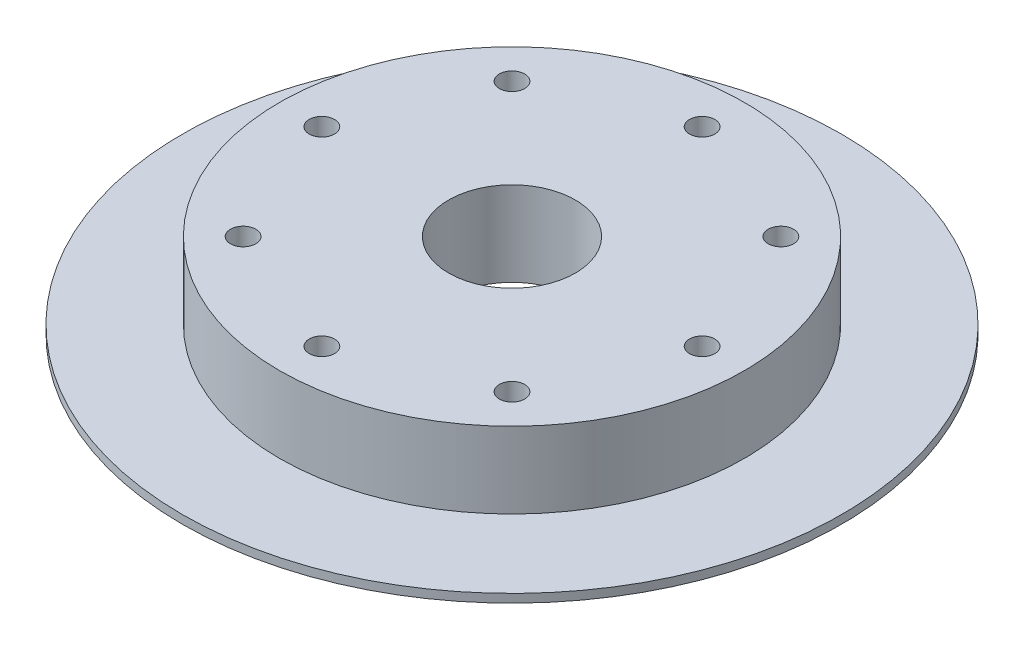
from build123d import *

# Parameters (mm, degrees)
SKETCH1_R           = 39
SKETCH1_R_2         = 1.5
SKETCH1_R_3         = 7.5
BOSS_EXTRUDE1_DEPTH = 1
BOSS_EXTRUDE2_START = 9
SKETCH1_3_R         = 27.5
SKETCH1_3_R_2       = 1.5
SKETCH1_3_R_3       = 7.5
BOSS_EXTRUDE2_DEPTH = 9


with BuildPart() as part:
    # Sketch1 → Boss-Extrude1 (new body)
    with BuildSketch(Plane(origin=(0, 0, 0), x_dir=(1, 0, 0), z_dir=(0, 1, 0))):
        Circle(SKETCH1_R)
        with Locations((22.5, 0)):
            Circle(SKETCH1_R_2, mode=Mode.SUBTRACT)
        with Locations((-15.909902577, -15.909902577)):
            Circle(SKETCH1_R_2, mode=Mode.SUBTRACT)
        with Locations((0, -22.5)):
            Circle(SKETCH1_R_2, mode=Mode.SUBTRACT)
        with Locations((15.909902577, -15.909902577)):
            Circle(SKETCH1_R_2, mode=Mode.SUBTRACT)
        with Locations((-22.5, 0)):
            Circle(SKETCH1_R_2, mode=Mode.SUBTRACT)
        with Locations((-15.909902577, 15.909902577)):
            Circle(SKETCH1_R_2, mode=Mode.SUBTRACT)
        with Locations((0, 22.5)):
            Circle(SKETCH1_R_2, mode=Mode.SUBTRACT)
        Circle(SKETCH1_R_3, mode=Mode.SUBTRACT)
        with Locations((15.909902577, 15.909902577)):
            Circle(SKETCH1_R_2, mode=Mode.SUBTRACT)
    extrude(amount=-BOSS_EXTRUDE1_DEPTH)

    # Sketch1<3> → Boss-Extrude2 (add)
    with BuildSketch(Plane(origin=(0, 0, 0), x_dir=(1, 0, 0), z_dir=(0, 1, 0)).offset(BOSS_EXTRUDE2_START)):
        Circle(SKETCH1_3_R)
        with Locations((-15.909902577, -15.909902577)):
            Circle(SKETCH1_3_R_2, mode=Mode.SUBTRACT)
        with Locations((0, -22.5)):
            Circle(SKETCH1_3_R_2, mode=Mode.SUBTRACT)
        with Locations((15.909902577, -15.909902577)):
            Circle(SKETCH1_3_R_2, mode=Mode.SUBTRACT)
        with Locations((-22.5, 0)):
            Circle(SKETCH1_3_R_2, mode=Mode.SUBTRACT)
        with Locations((-15.909902577, 15.909902577)):
            Circle(SKETCH1_3_R_2, mode=Mode.SUBTRACT)
        with Locations((0, 22.5)):
            Circle(SKETCH1_3_R_2, mode=Mode.SUBTRACT)
        Circle(SKETCH1_3_R_3, mode=Mode.SUBTRACT)
        with Locations((15.909902577, 15.909902577)):
            Circle(SKETCH1_3_R_2, mode=Mode.SUBTRACT)
        with Locations((22.5, 0)):
            Circle(SKETCH1_3_R_2, mode=Mode.SUBTRACT)
    extrude(amount=-BOSS_EXTRUDE2_DEPTH)


solid = part.part
